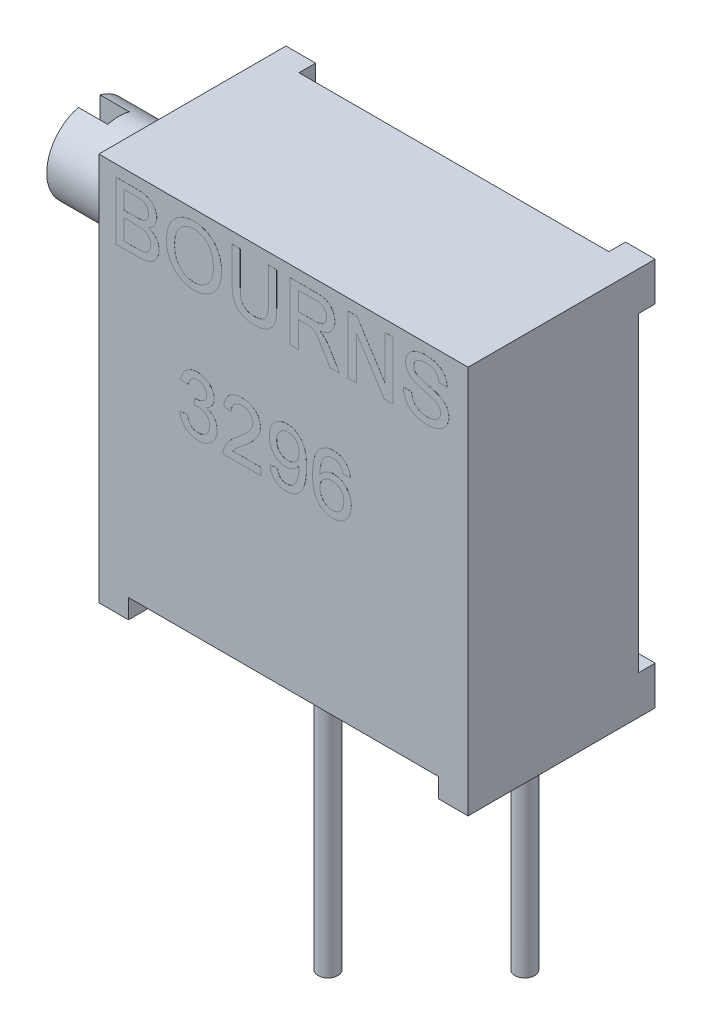
from build123d import *

# Parameters (mm, degrees)
SKETCH1_W          = 9.53
SKETCH1_H          = 10.03
EXTRUDE1_DEPTH     = 4.4
SKETCH2_W          = 8
SKETCH2_H          = 0.5
CUT_EXTRUDE1_DEPTH = 12.94429257
SKETCH3_W          = 0.765
SKETCH3_H          = 1
EXTRUDE2_DEPTH     = 0.43
EXTRUDE5_DEPTH     = 0.001
SKETCH9_R          = 0.255
EXTRUDE7_DEPTH     = 6.9
SKETCH_1_R         = 1.095
EXTRUDE8_DEPTH     = 1.52
SKETCH_2_W         = 0.56
SKETCH_2_H         = 4.322685763
CUT_EXTRUDE3_DEPTH = 0.76


with BuildPart() as part:
    # Sketch1 → Extrude1 (new body)
    with BuildSketch(Plane.XY):
        with Locations((0, 5.015)):
            Rectangle(SKETCH1_W, SKETCH1_H)
    extrude(amount=EXTRUDE1_DEPTH)

    # Sketch2 → Cut-Extrude1 (cut, through all)
    with BuildSketch(Plane.XY.offset(4.4)):
        with Locations((0, 0.25)):
            Rectangle(SKETCH2_W, SKETCH2_H)
    extrude(amount=-CUT_EXTRUDE1_DEPTH, mode=Mode.SUBTRACT)

    # Sketch3 → Extrude2 (add)
    with BuildSketch(Plane(origin=(0, 0, 0), x_dir=(-1, 0, 0), z_dir=(0, 0, -1))):
        with Locations((-4.3825, 0.5)):
            Rectangle(SKETCH3_W, SKETCH3_H)
        with Locations((4.3825, 0.5)):
            Rectangle(SKETCH3_W, SKETCH3_H)
        with Locations((4.3825, 9.53)):
            Rectangle(SKETCH3_W, SKETCH3_H)
        with Locations((-4.3825, 9.53)):
            Rectangle(SKETCH3_W, SKETCH3_H)
    extrude(amount=EXTRUDE2_DEPTH)

    # Sketch7 → Extrude5 (add)
    # profile 1 of 10: a face of its own
    with BuildSketch(Plane.XY.offset(4.4)):
        with BuildLine():
            Line((-4.326444342, 8.237150921), (-4.326444342, 9.737150921))
            Line((-4.326444342, 9.737150921), (-3.764845784, 9.737150921))
            add(Edge.make_bspline(
                [(-3.764845784, 9.737150921), (-3.750919069, 9.737097495), (-3.723744088, 9.736993245), (-3.684062996, 9.734386066), (-3.64648204, 9.730819986), (-3.610920315, 9.726223199), (-3.577531697, 9.719553354), (-3.5463473, 9.711473284), (-3.517204841, 9.702153183), (-3.481582627, 9.687955652), (-3.44053193, 9.666102632), (-3.396562734, 9.63349448), (-3.358307825, 9.594343785), (-3.326829661, 9.549455296), (-3.300895048, 9.501505925), (-3.282507712, 9.451409151), (-3.270751692, 9.400255705), (-3.269417834, 9.365618225), (-3.268752034, 9.348328806)],
                knots=[0, 0, 0, 0, 0.939712594, 1.833646414, 2.682508961, 3.487467313, 4.25240329, 4.978730417, 5.660668875, 6.315918528, 7.564895217, 8.787077865, 9.996481721, 11.241996224, 12.475862915, 13.665015424, 14.834484263, 16, 16, 16, 16], degree=3))
            add(Edge.make_bspline(
                [(-3.268752034, 9.348328806), (-3.26945193, 9.332243346), (-3.270844975, 9.300227505), (-3.281932051, 9.253066225), (-3.29943085, 9.207272915), (-3.324174647, 9.163404285), (-3.35580032, 9.122262901), (-3.395007125, 9.085240754), (-3.441231661, 9.052258501), (-3.475923175, 9.03467799), (-3.49381213, 9.025612459)],
                knots=[0, 0, 0, 0, 0.926741525, 1.844548388, 2.778836836, 3.746021974, 4.738420572, 5.759761325, 6.844803049, 8, 8, 8, 8], degree=3))
            add(Edge.make_bspline(
                [(-3.49381213, 9.025612459), (-3.482745904, 9.022148256), (-3.461080115, 9.015365935), (-3.429933293, 9.002955239), (-3.40069594, 8.988823885), (-3.373304413, 8.972948652), (-3.347943795, 8.955182527), (-3.324685642, 8.935497814), (-3.303368694, 8.914199128), (-3.284031035, 8.891299426), (-3.267044931, 8.866946071), (-3.251810517, 8.841671332), (-3.2392306, 8.815170846), (-3.228919301, 8.787513414), (-3.220874955, 8.758869935), (-3.215098238, 8.729130241), (-3.211805658, 8.698363557), (-3.211311122, 8.677463121), (-3.211059726, 8.666838421)],
                knots=[0, 0, 0, 0, 1.127427615, 2.20731145, 3.257257018, 4.283066884, 5.282973838, 6.264540225, 7.242620376, 8.210460609, 9.17525685, 10.12748095, 11.077310519, 12.023587065, 12.994999128, 13.967387486, 14.966724908, 16, 16, 16, 16], degree=3))
            add(Edge.make_bspline(
                [(-3.211059726, 8.666838421), (-3.211577892, 8.649780613), (-3.212604959, 8.615969962), (-3.220853456, 8.56620637), (-3.234792977, 8.518337989), (-3.253979542, 8.473138792), (-3.276841107, 8.43134548), (-3.302824076, 8.394052338), (-3.331265831, 8.36164311), (-3.362967261, 8.334381157), (-3.397723879, 8.311243736), (-3.436517359, 8.291760514), (-3.479047757, 8.27457818), (-3.526179479, 8.260852297), (-3.577891071, 8.249948474), (-3.634884306, 8.242864242), (-3.697246747, 8.237792882), (-3.74069542, 8.237370888), (-3.76334338, 8.237150921)],
                knots=[0, 0, 0, 0, 1.028073207, 2.037766189, 3.031549473, 4.027532207, 4.992436545, 5.898794514, 6.762903869, 7.584966804, 8.412380356, 9.273953678, 10.198004568, 11.174406109, 12.229717296, 13.381036288, 14.634844708, 16, 16, 16, 16], degree=3))
            Line((-3.76334338, 8.237150921), (-4.326444342, 8.237150921))
        make_face()
        with BuildLine():
            Line((-4.11490588, 9.102535536), (-3.805711169, 9.102535536))
            add(Edge.make_bspline(
                [(-3.805711169, 9.102535536), (-3.795593548, 9.102575565), (-3.776155313, 9.10265247), (-3.748116122, 9.103724756), (-3.722237293, 9.104639569), (-3.698618928, 9.106935678), (-3.677144021, 9.109184615), (-3.65789851, 9.112212035), (-3.640788132, 9.115623251), (-3.630311444, 9.11878741), (-3.625422707, 9.120263902)],
                knots=[0, 0, 0, 0, 1.335841395, 2.566453063, 3.705076039, 4.753984432, 5.69893722, 6.555639608, 7.326018133, 8, 8, 8, 8], degree=3))
            add(Edge.make_bspline(
                [(-3.625422707, 9.120263902), (-3.613935929, 9.124287721), (-3.591791825, 9.132044802), (-3.562116654, 9.149661914), (-3.536842034, 9.170802362), (-3.516035695, 9.195839435), (-3.500047055, 9.224639144), (-3.48819194, 9.256604254), (-3.481701001, 9.292181608), (-3.480773445, 9.316853252), (-3.480290496, 9.329698998)],
                knots=[0, 0, 0, 0, 1.059015028, 2.041559358, 2.989777133, 3.920090524, 4.862499371, 5.848878527, 6.879979022, 8, 8, 8, 8], degree=3))
            add(Edge.make_bspline(
                [(-3.480290496, 9.329698998), (-3.480678819, 9.342044591), (-3.481435618, 9.366104727), (-3.487788265, 9.401044217), (-3.498781285, 9.433548996), (-3.513668845, 9.463611935), (-3.532520451, 9.490357237), (-3.555020501, 9.513351936), (-3.581973973, 9.530734916), (-3.607167395, 9.541578455), (-3.629826882, 9.548362111), (-3.650072338, 9.552375722), (-3.673036723, 9.555912112), (-3.698795607, 9.558918633), (-3.727358734, 9.56125197), (-3.758814112, 9.563105652), (-3.793086864, 9.56389268), (-3.816828774, 9.564012054), (-3.829148669, 9.564073998)],
                knots=[0, 0, 0, 0, 1.216168307, 2.37017178, 3.484610845, 4.588286376, 5.664695412, 6.69777344, 7.738183022, 8.803673002, 9.390844981, 10.0665252, 10.835811589, 11.680682236, 12.621801058, 13.660007223, 14.785756265, 16, 16, 16, 16], degree=3))
            Line((-3.829148669, 9.564073998), (-4.11490588, 9.564073998))
            Line((-4.11490588, 9.564073998), (-4.11490588, 9.102535536))
        make_face(mode=Mode.SUBTRACT)
        with BuildLine():
            Line((-4.11490588, 8.410227844), (-3.760038092, 8.410227844))
            add(Edge.make_bspline(
                [(-3.760038092, 8.410227844), (-3.745915172, 8.410390096), (-3.719967473, 8.410688199), (-3.68447609, 8.41162336), (-3.655788079, 8.41390761), (-3.639035797, 8.416367164), (-3.631732803, 8.417439383)],
                knots=[0, 0, 0, 0, 1.317581857, 2.420761387, 3.311546315, 4, 4, 4, 4], degree=3))
            add(Edge.make_bspline(
                [(-3.631732803, 8.417439383), (-3.621262478, 8.419640139), (-3.60098922, 8.423901372), (-3.572408792, 8.433412), (-3.546204152, 8.444306931), (-3.522832664, 8.458153179), (-3.501191226, 8.47411003), (-3.482383206, 8.494040902), (-3.465060127, 8.516685746), (-3.450051204, 8.542600195), (-3.43791431, 8.571268479), (-3.42863829, 8.602247654), (-3.423697206, 8.635429101), (-3.422969697, 8.658209966), (-3.422598188, 8.669843229)],
                knots=[0, 0, 0, 0, 1.067651492, 2.067249321, 3.003744366, 3.895862395, 4.774133402, 5.679610569, 6.621910665, 7.616993802, 8.661192143, 9.724711987, 10.838102842, 12, 12, 12, 12], degree=3))
            add(Edge.make_bspline(
                [(-3.422598188, 8.669843229), (-3.42301209, 8.683501376), (-3.42381924, 8.710136157), (-3.431491485, 8.748624765), (-3.444164778, 8.784323428), (-3.462005081, 8.816737755), (-3.483887144, 8.845891651), (-3.51036223, 8.870622107), (-3.541232376, 8.890246947), (-3.576592458, 8.905648649), (-3.617921311, 8.916606694), (-3.666359943, 8.924041064), (-3.722683143, 8.928838285), (-3.762931606, 8.929242981), (-3.784377034, 8.929458613)],
                knots=[0, 0, 0, 0, 0.96167883, 1.875371887, 2.752872588, 3.621584364, 4.472914353, 5.312011319, 6.159851575, 7.038572308, 8.019870099, 9.164119506, 10.488969081, 12, 12, 12, 12], degree=3))
            Line((-3.784377034, 8.929458613), (-4.11490588, 8.929458613))
            Line((-4.11490588, 8.929458613), (-4.11490588, 8.410227844))
        make_face(mode=Mode.SUBTRACT)
    # profile 2 of 10: a face of its own
    with BuildSketch(Plane.XY.offset(4.4)):
        with BuildLine():
            add(Edge.make_bspline(
                [(-3.018752034, 8.96731919), (-3.018230692, 8.997392897), (-3.017214883, 9.055989991), (-3.007723632, 9.141314909), (-2.992312277, 9.221594495), (-2.970280381, 9.296822497), (-2.942354889, 9.367116795), (-2.90840612, 9.432636561), (-2.867412916, 9.492640158), (-2.821039156, 9.547698782), (-2.769241797, 9.596374641), (-2.714092331, 9.639605778), (-2.654902115, 9.675665657), (-2.592218021, 9.705439229), (-2.525773732, 9.728298516), (-2.455755803, 9.744302096), (-2.382239117, 9.754625961), (-2.331988742, 9.755787946), (-2.30631213, 9.75638169)],
                knots=[0, 0, 0, 0, 1.203621547, 2.345195544, 3.432004029, 4.472479546, 5.478447225, 6.455936844, 7.420185704, 8.381829745, 9.332027588, 10.260832629, 11.182364398, 12.100723901, 13.034044877, 13.989196293, 14.972532542, 16, 16, 16, 16], degree=3))
            add(Edge.make_bspline(
                [(-2.30631213, 9.75638169), (-2.289376641, 9.756085965), (-2.255745821, 9.755498707), (-2.206025657, 9.751030463), (-2.157583125, 9.74305542), (-2.110465931, 9.732367968), (-2.064545821, 9.718346497), (-2.019795371, 9.701794576), (-1.976606323, 9.681284416), (-1.934691352, 9.658321251), (-1.894545231, 9.632635958), (-1.856816008, 9.604261466), (-1.821594055, 9.573412372), (-1.788406246, 9.540595749), (-1.758360012, 9.504704083), (-1.730214065, 9.466830696), (-1.704777197, 9.426304031), (-1.681959152, 9.383456134), (-1.661557501, 9.338948785), (-1.644120351, 9.292597519), (-1.629147388, 9.24495835), (-1.616613755, 9.195749307), (-1.607620535, 9.144987212), (-1.600459136, 9.092890794), (-1.596689895, 9.039289785), (-1.596016226, 9.003081348), (-1.595675111, 8.984747075)],
                knots=[0, 0, 0, 0, 1.034375294, 2.054082248, 3.045783978, 4.031219655, 5.002789406, 5.976610191, 6.94273282, 7.920236376, 8.894345378, 9.851183672, 10.800797181, 11.752517031, 12.698794154, 13.65688337, 14.632873302, 15.61821402, 16.620222298, 17.621258913, 18.640965868, 19.669244166, 20.720417492, 21.788124603, 22.880008887, 24, 24, 24, 24], degree=3))
            add(Edge.make_bspline(
                [(-1.595675111, 8.984747075), (-1.595987646, 8.966110469), (-1.596605114, 8.929290641), (-1.600783152, 8.87489649), (-1.608129594, 8.822063882), (-1.617873399, 8.77063528), (-1.630929801, 8.720717747), (-1.646445328, 8.672168168), (-1.665212234, 8.625275712), (-1.686407371, 8.579927361), (-1.71038966, 8.536746809), (-1.736843752, 8.496035998), (-1.765788388, 8.458175743), (-1.796783902, 8.422701596), (-1.830554122, 8.390247902), (-1.866683213, 8.360511195), (-1.90503226, 8.333211022), (-1.945730096, 8.30908676), (-1.988046343, 8.287940982), (-2.031143628, 8.269180868), (-2.075053966, 8.253181495), (-2.119927428, 8.240215594), (-2.165641605, 8.230417626), (-2.21206785, 8.223080805), (-2.259358356, 8.218856237), (-2.291179863, 8.218233784), (-2.307213572, 8.217920152)],
                knots=[0, 0, 0, 0, 1.141429366, 2.255090526, 3.338676798, 4.407031443, 5.458968682, 6.496860253, 7.526652771, 8.550250826, 9.560787671, 10.54935636, 11.521089193, 12.477323897, 13.431786008, 14.386110112, 15.340986122, 16.312041, 17.28047646, 18.236612773, 19.189437236, 20.140779471, 21.09494583, 22.051062463, 23.018000708, 24, 24, 24, 24], degree=3))
            add(Edge.make_bspline(
                [(-2.307213572, 8.217920152), (-2.324453371, 8.218175217), (-2.358601094, 8.218680436), (-2.409072348, 8.223723391), (-2.458287957, 8.231416594), (-2.506104842, 8.242523255), (-2.552457663, 8.25701268), (-2.597401266, 8.27455022), (-2.641093722, 8.294901493), (-2.682992881, 8.318649222), (-2.722956135, 8.345054144), (-2.760596145, 8.373985002), (-2.795892098, 8.405175171), (-2.828277639, 8.439140188), (-2.858801633, 8.474648809), (-2.886243593, 8.513020865), (-2.911499732, 8.55338612), (-2.933822678, 8.596133677), (-2.95398812, 8.639993241), (-2.97097794, 8.68497884), (-2.985908699, 8.730427507), (-2.997799537, 8.776619369), (-3.007275088, 8.823447871), (-3.01364671, 8.870835093), (-3.018248343, 8.918851609), (-3.018583292, 8.951082028), (-3.018752034, 8.96731919)],
                knots=[0, 0, 0, 0, 1.072727997, 2.12480551, 3.153819198, 4.171534612, 5.177148798, 6.173931848, 7.17235114, 8.174500385, 9.168706755, 10.151274001, 11.127173509, 12.097141049, 13.070188938, 14.039134204, 15.03036519, 16.031505612, 17.038625933, 18.033164522, 19.022845559, 20.014762458, 21.000193215, 21.994692725, 22.989758729, 24, 24, 24, 24], degree=3))
        make_face()
        with BuildLine():
            add(Edge.make_bspline(
                [(-2.807213572, 8.964915344), (-2.8068894, 8.943259561), (-2.806257286, 8.901032314), (-2.799025562, 8.839467232), (-2.788052575, 8.781377442), (-2.772927471, 8.726599873), (-2.752595628, 8.675676265), (-2.728286277, 8.628117292), (-2.699180916, 8.584239101), (-2.665921697, 8.544164434), (-2.629340369, 8.508164356), (-2.590249507, 8.476720203), (-2.548640324, 8.450387949), (-2.504974133, 8.428645052), (-2.458937298, 8.411672739), (-2.410667702, 8.399755208), (-2.360129877, 8.39230176), (-2.325669313, 8.391437388), (-2.308115015, 8.390997075)],
                knots=[0, 0, 0, 0, 1.215430442, 2.370003584, 3.475209778, 4.53279855, 5.55522989, 6.548792651, 7.526809858, 8.505409025, 9.467826767, 10.404123909, 11.316848639, 12.227335424, 13.138360512, 14.065900994, 15.014765094, 16, 16, 16, 16], degree=3))
            add(Edge.make_bspline(
                [(-2.308115015, 8.390997075), (-2.290263171, 8.3914439), (-2.25530931, 8.392318784), (-2.204009559, 8.399642118), (-2.155269053, 8.412109783), (-2.108604686, 8.42870707), (-2.064860106, 8.451143772), (-2.02301225, 8.477417027), (-1.984201898, 8.509522192), (-1.947476365, 8.54558594), (-1.914536035, 8.586579013), (-1.885308427, 8.631491621), (-1.861565976, 8.680997339), (-1.841067574, 8.734005623), (-1.826057462, 8.791518352), (-1.81496407, 8.85288172), (-1.808278957, 8.918293114), (-1.80757498, 8.963196823), (-1.807213572, 8.986249479)],
                knots=[0, 0, 0, 0, 0.976878588, 1.912725521, 2.8289017, 3.727303729, 4.617335839, 5.514666588, 6.426584173, 7.368641557, 8.327632997, 9.299405846, 10.294892156, 11.327373912, 12.405931897, 13.542618837, 14.738430195, 16, 16, 16, 16], degree=3))
            add(Edge.make_bspline(
                [(-1.807213572, 8.986249479), (-1.807341294, 9.001080057), (-1.807591837, 9.030172285), (-1.810909864, 9.073054562), (-1.815189695, 9.114602954), (-1.821705802, 9.15476385), (-1.830685826, 9.193370934), (-1.840634167, 9.230718122), (-1.853074219, 9.266483577), (-1.867189192, 9.300807558), (-1.882983608, 9.333513851), (-1.900797609, 9.36432673), (-1.920424159, 9.3931264), (-1.941333711, 9.420458875), (-1.964684118, 9.445266276), (-1.989351045, 9.468596479), (-2.015894798, 9.489967476), (-2.044050482, 9.509384851), (-2.073418672, 9.526863548), (-2.103938825, 9.541823045), (-2.135124711, 9.554963084), (-2.167498339, 9.565035475), (-2.200612691, 9.573159006), (-2.234601633, 9.579329585), (-2.269591323, 9.582524997), (-2.293185557, 9.583042977), (-2.305110207, 9.583304767)],
                knots=[0, 0, 0, 0, 1.220438779, 2.394059227, 3.538503547, 4.658058814, 5.74010225, 6.800155734, 7.837851593, 8.854470756, 9.853724944, 10.825214244, 11.781044712, 12.72106398, 13.654479919, 14.581868691, 15.514082315, 16.456304431, 17.39516604, 18.324312202, 19.252140633, 20.177768678, 21.111585046, 22.057694709, 23.018348693, 24, 24, 24, 24], degree=3))
            add(Edge.make_bspline(
                [(-2.305110207, 9.583304767), (-2.321964073, 9.582970056), (-2.355218629, 9.582309634), (-2.404173295, 9.574968014), (-2.4513709, 9.56399863), (-2.496884691, 9.548662848), (-2.540325395, 9.528355862), (-2.581918075, 9.503452123), (-2.622031926, 9.47462972), (-2.660034411, 9.441186401), (-2.695461039, 9.402768193), (-2.725410699, 9.357474302), (-2.750653091, 9.30638599), (-2.771730023, 9.249632752), (-2.787800563, 9.186775074), (-2.798907316, 9.11808346), (-2.805919894, 9.043485528), (-2.806771322, 8.991774955), (-2.807213572, 8.964915344)],
                knots=[0, 0, 0, 0, 0.895090134, 1.766112571, 2.624765742, 3.468151641, 4.313618154, 5.168136083, 6.041303099, 6.935189387, 7.854749729, 8.809996334, 9.809869957, 10.877771942, 12.021723904, 13.25217762, 14.572720513, 16, 16, 16, 16], degree=3))
        make_face(mode=Mode.SUBTRACT)
    # profile 3 of 10: a face of its own
    with BuildSketch(Plane.XY.offset(4.4)):
        with BuildLine():
            Line((-0.384136649, 9.737150921), (-0.172598188, 9.737150921))
            Line((-0.172598188, 9.737150921), (-0.172598188, 8.874170152))
            add(Edge.make_bspline(
                [(-0.172598188, 8.874170152), (-0.172817713, 8.855839279), (-0.17324491, 8.820167371), (-0.175210197, 8.768143941), (-0.179038667, 8.719011196), (-0.184899968, 8.672848597), (-0.19152619, 8.629455925), (-0.200351288, 8.589070404), (-0.210472953, 8.551529041), (-0.222118871, 8.516578197), (-0.236215171, 8.483981753), (-0.252320236, 8.453041696), (-0.27110134, 8.423667691), (-0.292509773, 8.395904321), (-0.316659126, 8.369903341), (-0.342889972, 8.34499824), (-0.371894747, 8.32187367), (-0.403354379, 8.300264922), (-0.437307933, 8.280653275), (-0.473904053, 8.263733066), (-0.513098094, 8.24978275), (-0.554713075, 8.237914738), (-0.59895675, 8.229115881), (-0.645687182, 8.222441781), (-0.694966239, 8.218516166), (-0.728680904, 8.218121765), (-0.745915496, 8.217920152)],
                knots=[0, 0, 0, 0, 1.311435591, 2.552055809, 3.723716842, 4.835547674, 5.880436826, 6.862821995, 7.791032428, 8.661143393, 9.495683908, 10.328993084, 11.1538804, 11.986573222, 12.833449924, 13.690091648, 14.571895854, 15.484149563, 16.418232274, 17.373591634, 18.364096258, 19.391643703, 20.466661433, 21.588422397, 22.767226238, 24, 24, 24, 24], degree=3))
            add(Edge.make_bspline(
                [(-0.745915496, 8.217920152), (-0.762747176, 8.218167913), (-0.795542393, 8.218650658), (-0.843600901, 8.221914973), (-0.889315102, 8.227699697), (-0.932822961, 8.235291305), (-0.973978437, 8.245579942), (-1.01272043, 8.258173326), (-1.049181209, 8.272904412), (-1.083365134, 8.2896649), (-1.11487259, 8.309015777), (-1.144260591, 8.330138013), (-1.171397739, 8.353261603), (-1.19603194, 8.378594967), (-1.218455258, 8.405756623), (-1.238355176, 8.435036855), (-1.255779343, 8.466487887), (-1.271165901, 8.500026899), (-1.284571795, 8.536147585), (-1.295381776, 8.575342209), (-1.305161568, 8.617510171), (-1.312667758, 8.662804669), (-1.319261137, 8.711168829), (-1.323084681, 8.762745583), (-1.325997838, 8.817446196), (-1.326292931, 8.854934905), (-1.326444342, 8.874170152)],
                knots=[0, 0, 0, 0, 1.192889473, 2.324252067, 3.41162405, 4.457325556, 5.452435892, 6.415456921, 7.342133401, 8.237363544, 9.110250727, 9.959377435, 10.800155199, 11.633438097, 12.46053001, 13.293359256, 14.138649731, 15.005774073, 15.906391469, 16.865847877, 17.8852706, 18.972920589, 20.118424796, 21.343408205, 22.636917643, 24, 24, 24, 24], degree=3))
            Line((-1.326444342, 8.874170152), (-1.326444342, 9.737150921))
            Line((-1.326444342, 9.737150921), (-1.11490588, 9.737150921))
            Line((-1.11490588, 9.737150921), (-1.11490588, 8.884086017))
            add(Edge.make_bspline(
                [(-1.11490588, 8.884086017), (-1.114767658, 8.868560422), (-1.114500957, 8.838603557), (-1.113109482, 8.795207672), (-1.110326775, 8.754936554), (-1.106886612, 8.717728723), (-1.102157025, 8.683718544), (-1.09610028, 8.652955825), (-1.089306625, 8.625335805), (-1.079133218, 8.593035516), (-1.062246323, 8.556979041), (-1.035633784, 8.518762127), (-1.003161194, 8.485560874), (-0.964517851, 8.458141879), (-0.920633994, 8.436355447), (-0.871805449, 8.421333433), (-0.818611502, 8.411672805), (-0.781617528, 8.410721136), (-0.762441938, 8.410227844)],
                knots=[0, 0, 0, 0, 1.090245215, 2.103644224, 3.048223674, 3.924421557, 4.727106666, 5.45815927, 6.12513286, 6.723455763, 7.834131158, 8.905266051, 9.9795367, 11.078391299, 12.21701853, 13.404826756, 14.65480846, 16, 16, 16, 16], degree=3))
            add(Edge.make_bspline(
                [(-0.762441938, 8.410227844), (-0.746007063, 8.410507631), (-0.714272984, 8.411047872), (-0.668513344, 8.415404728), (-0.6265627, 8.423347367), (-0.588072882, 8.433582839), (-0.553314751, 8.447483141), (-0.522075787, 8.464324146), (-0.494465601, 8.484196483), (-0.470286071, 8.507638528), (-0.449452221, 8.535691341), (-0.431893065, 8.569123488), (-0.416934773, 8.607964106), (-0.404676645, 8.652341416), (-0.395738752, 8.702466188), (-0.388751711, 8.758015588), (-0.385088051, 8.819233831), (-0.384462913, 8.861846319), (-0.384136649, 8.884086017)],
                knots=[0, 0, 0, 0, 1.111629428, 2.146443922, 3.104513091, 3.997025448, 4.836178689, 5.630482806, 6.392099463, 7.129930272, 7.899580577, 8.745272349, 9.676297551, 10.710246713, 11.854352966, 13.117392195, 14.495550762, 16, 16, 16, 16], degree=3))
            Line((-0.384136649, 8.884086017), (-0.384136649, 9.737150921))
        make_face()
    # profile 4 of 10: a face of its own
    with BuildSketch(Plane.XY.offset(4.4)):
        with BuildLine():
            Line((0.173555658, 8.237150921), (0.173555658, 9.737150921))
            Line((0.173555658, 9.737150921), (0.824397004, 9.737150921))
            add(Edge.make_bspline(
                [(0.824397004, 9.737150921), (0.839722325, 9.737030841), (0.86938269, 9.73679844), (0.912396343, 9.735153303), (0.952545276, 9.731606819), (0.98990331, 9.727771792), (1.024463806, 9.721885537), (1.05619111, 9.715134136), (1.085134208, 9.707099866), (1.111422492, 9.697610774), (1.135812287, 9.686875288), (1.158419785, 9.673629431), (1.18018475, 9.659114797), (1.200299409, 9.642062268), (1.219294287, 9.623391327), (1.237151779, 9.602848275), (1.25360752, 9.580254841), (1.273903706, 9.547918952), (1.295677375, 9.504854357), (1.313818262, 9.449741006), (1.325515181, 9.39209043), (1.326766785, 9.352692939), (1.327401812, 9.332703806)],
                knots=[0, 0, 0, 0, 1.242255013, 2.404239178, 3.487702428, 4.508875116, 5.447164253, 6.327763259, 7.137389581, 7.87956647, 8.591787438, 9.293660819, 10.000726923, 10.709654955, 11.427269343, 12.158170644, 12.913245971, 13.690346794, 15.251572448, 16.809945773, 18.381459854, 20, 20, 20, 20], degree=3))
            add(Edge.make_bspline(
                [(1.327401812, 9.332703806), (1.327108288, 9.319872565), (1.326528558, 9.294529983), (1.322087769, 9.257269606), (1.314052519, 9.221668814), (1.303748895, 9.187415821), (1.289646376, 9.154995938), (1.273309221, 9.123746979), (1.253069809, 9.094527437), (1.230409548, 9.066559241), (1.204424306, 9.040441395), (1.17488549, 9.017116168), (1.142085913, 8.99613508), (1.105871101, 8.978077007), (1.066657924, 8.96157107), (1.023954363, 8.948279695), (0.977932767, 8.937426268), (0.946028457, 8.93217062), (0.929565274, 8.929458613)],
                knots=[0, 0, 0, 0, 0.982609109, 1.940720374, 2.867584677, 3.775009516, 4.675469332, 5.571146231, 6.471115823, 7.392408543, 8.32534739, 9.286126426, 10.269214477, 11.301811357, 12.381622301, 13.524260118, 14.722474812, 16, 16, 16, 16], degree=3))
            add(Edge.make_bspline(
                [(0.929565274, 8.929458613), (0.941641642, 8.923357898), (0.964575101, 8.911772421), (0.996326759, 8.893606493), (1.02324154, 8.875045391), (1.038834637, 8.861769945), (1.046151812, 8.855540344)],
                knots=[0, 0, 0, 0, 1.172304973, 2.226249348, 3.167654437, 4, 4, 4, 4], degree=3))
            add(Edge.make_bspline(
                [(1.046151812, 8.855540344), (1.060321936, 8.841649482), (1.089428377, 8.813116664), (1.129538316, 8.764516917), (1.16842628, 8.710417941), (1.192053651, 8.671320427), (1.204204697, 8.651213421)],
                knots=[0, 0, 0, 0, 0.918110279, 1.885863737, 2.912745394, 4, 4, 4, 4], degree=3))
            Line((1.204204697, 8.651213421), (1.450298447, 8.237150921))
            Line((1.450298447, 8.237150921), (1.207810466, 8.237150921))
            Line((1.207810466, 8.237150921), (1.020911428, 8.553857652))
            add(Edge.make_bspline(
                [(1.020911428, 8.553857652), (1.014191477, 8.564969688), (1.001169316, 8.58650299), (0.982359271, 8.617951341), (0.96391664, 8.646904558), (0.946811416, 8.674190141), (0.930349439, 8.699312734), (0.914689771, 8.722359607), (0.900263372, 8.743633105), (0.882394413, 8.768400992), (0.861597912, 8.79580689), (0.837329822, 8.82402979), (0.814219405, 8.846531531), (0.7857585, 8.868596883), (0.750505364, 8.88923531), (0.720539532, 8.898718101), (0.706007581, 8.903316786)],
                knots=[0, 0, 0, 0, 1.130940588, 2.191577161, 3.191089816, 4.120344442, 4.99615009, 5.80661983, 6.546979556, 7.234477901, 8.466216387, 9.541989141, 10.473533583, 11.269175393, 12.675684693, 14, 14, 14, 14], degree=3))
            add(Edge.make_bspline(
                [(0.706007581, 8.903316786), (0.699910513, 8.904416295), (0.685990724, 8.906926506), (0.662354957, 8.908565929), (0.633717326, 8.910305957), (0.612963146, 8.910255258), (0.601740754, 8.910227844)],
                knots=[0, 0, 0, 0, 0.709978628, 1.620902492, 2.713552433, 4, 4, 4, 4], degree=3))
            Line((0.601740754, 8.910227844), (0.38509412, 8.910227844))
            Line((0.38509412, 8.910227844), (0.38509412, 8.237150921))
            Line((0.38509412, 8.237150921), (0.173555658, 8.237150921))
        make_face()
        with BuildLine():
            Line((0.38509412, 9.083304767), (0.786836908, 9.083304767))
            add(Edge.make_bspline(
                [(0.786836908, 9.083304767), (0.806981813, 9.083619953), (0.844640824, 9.084209164), (0.897300993, 9.089240406), (0.942179174, 9.097235264), (0.980162544, 9.108896699), (1.012074571, 9.125086645), (1.039829066, 9.144817119), (1.062893402, 9.169531591), (1.082080546, 9.197416611), (1.096995107, 9.228102684), (1.10775376, 9.260333904), (1.114795486, 9.29383939), (1.115504243, 9.31664276), (1.115863351, 9.328196594)],
                knots=[0, 0, 0, 0, 1.546323217, 2.890706218, 4.056530419, 5.041445823, 5.928701482, 6.793137403, 7.641659452, 8.509781392, 9.383301667, 10.251423607, 11.114044887, 12, 12, 12, 12], degree=3))
            add(Edge.make_bspline(
                [(1.115863351, 9.328196594), (1.115584159, 9.336616312), (1.115037306, 9.353108067), (1.11217052, 9.377313385), (1.106596807, 9.400314031), (1.099236732, 9.422231591), (1.089402179, 9.442905533), (1.07771913, 9.462496058), (1.063777647, 9.480894587), (1.047808481, 9.498157164), (1.029472975, 9.513864423), (1.008529518, 9.52741638), (0.985143287, 9.538932621), (0.959287102, 9.548072679), (0.931042413, 9.555383237), (0.90024843, 9.560246716), (0.86704598, 9.563765913), (0.844038607, 9.563969384), (0.832209504, 9.564073998)],
                knots=[0, 0, 0, 0, 0.965208469, 1.890559848, 2.786986821, 3.67262109, 4.535197034, 5.405224191, 6.282113641, 7.175449223, 8.095446547, 9.040936516, 10.026471658, 11.075712529, 12.17809725, 13.364958037, 14.645208957, 16, 16, 16, 16], degree=3))
            Line((0.832209504, 9.564073998), (0.38509412, 9.564073998))
            Line((0.38509412, 9.564073998), (0.38509412, 9.083304767))
        make_face(mode=Mode.SUBTRACT)
    # profile 5 of 10: a face of its own
    with BuildSketch(Plane.XY.offset(4.4)):
        Polygon((1.673555658, 8.237150921), (1.673555658, 9.737150921), (1.897113351, 9.737150921), (2.615863351, 8.617860056), (2.615863351, 9.737150921), (2.827401812, 9.737150921), (2.827401812, 8.237150921), (2.60384412, 8.237150921), (1.88509412, 9.356441786), (1.88509412, 8.237150921), align=None)
    # profile 6 of 10: a face of its own
    with BuildSketch(Plane.XY.offset(4.4)):
        with BuildLine():
            Line((3.096632581, 8.75638169), (3.308171043, 8.75638169))
            add(Edge.make_bspline(
                [(3.308171043, 8.75638169), (3.310497843, 8.737388445), (3.314967752, 8.700901399), (3.327466063, 8.649186503), (3.343552197, 8.602689505), (3.363595075, 8.560793306), (3.389960718, 8.52400024), (3.421726783, 8.490813457), (3.460304939, 8.462075712), (3.503850884, 8.436501001), (3.552348913, 8.416420809), (3.604124885, 8.401535032), (3.658931873, 8.39271509), (3.696460325, 8.391577796), (3.715622966, 8.390997075)],
                knots=[0, 0, 0, 0, 1.125557648, 2.162256852, 3.1243583, 4.018160113, 4.88511607, 5.777380551, 6.711250965, 7.707237736, 8.743031335, 9.791730543, 10.872421559, 12, 12, 12, 12], degree=3))
            add(Edge.make_bspline(
                [(3.715622966, 8.390997075), (3.732580253, 8.391310936), (3.765643678, 8.391922905), (3.813473618, 8.399274166), (3.858481731, 8.409701733), (3.899830369, 8.42547506), (3.937367, 8.444628825), (3.969963359, 8.467795753), (3.997792396, 8.493921683), (4.019584549, 8.523694759), (4.03670403, 8.554891964), (4.049262938, 8.586959473), (4.056744023, 8.619719296), (4.057697308, 8.641761795), (4.058171043, 8.652715825)],
                knots=[0, 0, 0, 0, 1.267006637, 2.470417599, 3.611360613, 4.716023143, 5.771382139, 6.754486395, 7.697536124, 8.612899418, 9.501261124, 10.352596716, 11.181322154, 12, 12, 12, 12], degree=3))
            add(Edge.make_bspline(
                [(4.058171043, 8.652715825), (4.057664611, 8.663558897), (4.056674791, 8.684751666), (4.050224406, 8.71560569), (4.037964538, 8.743846084), (4.022055951, 8.770625489), (3.99992439, 8.795109454), (3.97196366, 8.817669243), (3.937557717, 8.838122166), (3.911878856, 8.849323379), (3.898315274, 8.855239863)],
                knots=[0, 0, 0, 0, 0.942140154, 1.841411588, 2.718743672, 3.605002079, 4.535543111, 5.568170452, 6.715506882, 8, 8, 8, 8], degree=3))
            add(Edge.make_bspline(
                [(3.898315274, 8.855239863), (3.893030701, 8.857408477), (3.881091893, 8.86230777), (3.860629335, 8.868793591), (3.836347919, 8.877180419), (3.807664303, 8.885817486), (3.774732043, 8.894954296), (3.737605968, 8.905295779), (3.696306823, 8.91629338), (3.652005924, 8.927999128), (3.607275516, 8.93990208), (3.564540836, 8.951816178), (3.5252229, 8.963910513), (3.488999639, 8.975555689), (3.456057801, 8.987248909), (3.42630389, 8.998670037), (3.39970081, 9.009587356), (3.383452661, 9.017614692), (3.375779216, 9.021405729)],
                knots=[0, 0, 0, 0, 0.499201778, 1.127787504, 1.87543728, 2.745208432, 3.745951656, 4.863402235, 6.114490242, 7.482339553, 8.869366102, 10.161191451, 11.360587006, 12.46547846, 13.487450326, 14.41601931, 15.251940103, 16, 16, 16, 16], degree=3))
            add(Edge.make_bspline(
                [(3.375779216, 9.021405729), (3.35812476, 9.030943175), (3.324047064, 9.049352927), (3.278182261, 9.082269616), (3.239536508, 9.118796776), (3.208272844, 9.158881439), (3.183772734, 9.201845678), (3.167242617, 9.247762533), (3.155920851, 9.295798527), (3.154862803, 9.328830804), (3.154324889, 9.345624479)],
                knots=[0, 0, 0, 0, 1.158441928, 2.236094408, 3.251151369, 4.220012324, 5.163146324, 6.095083285, 7.031536583, 8, 8, 8, 8], degree=3))
            add(Edge.make_bspline(
                [(3.154324889, 9.345624479), (3.155038808, 9.364220637), (3.156458787, 9.40120826), (3.169054782, 9.455485292), (3.189145635, 9.507714234), (3.212015126, 9.549179557), (3.234317935, 9.580535449), (3.252807132, 9.603117389), (3.273546383, 9.623991357), (3.295896991, 9.643448738), (3.320258496, 9.661198819), (3.346026486, 9.677971103), (3.374133618, 9.692387284), (3.413628319, 9.710735829), (3.466462713, 9.729058566), (3.532974606, 9.745024508), (3.60297619, 9.754426519), (3.650690914, 9.755720748), (3.675058062, 9.75638169)],
                knots=[0, 0, 0, 0, 1.199927478, 2.386647047, 3.578628709, 4.806592355, 5.433127754, 6.062729195, 6.689531802, 7.331674828, 7.974827539, 8.635320743, 9.315455226, 10.01318112, 11.447700238, 12.918145351, 14.426146008, 16, 16, 16, 16], degree=3))
            add(Edge.make_bspline(
                [(3.675058062, 9.75638169), (3.701729524, 9.755770554), (3.753664, 9.754580555), (3.829126262, 9.744679979), (3.899511893, 9.727678083), (3.954710721, 9.708646167), (3.995518568, 9.689378935), (4.024509599, 9.674344909), (4.051419009, 9.656962836), (4.076489036, 9.638152714), (4.099952547, 9.617923133), (4.121206478, 9.595792899), (4.141173733, 9.572517055), (4.16463804, 9.539100235), (4.189937537, 9.494873263), (4.211812397, 9.437575464), (4.22684068, 9.377102341), (4.229764027, 9.335295723), (4.231247966, 9.314073998)],
                knots=[0, 0, 0, 0, 1.607600973, 3.130308851, 4.577334065, 5.967726088, 6.640410691, 7.296826776, 7.935019992, 8.569057421, 9.185393759, 9.8003086, 10.417295362, 11.032210203, 12.259799365, 13.477607022, 14.719591916, 16, 16, 16, 16], degree=3))
            Line((4.231247966, 9.314073998), (4.019709504, 9.314073998))
            add(Edge.make_bspline(
                [(4.019709504, 9.314073998), (4.01836542, 9.324814934), (4.015735446, 9.345831762), (4.009210828, 9.376256782), (4.000064628, 9.404514172), (3.989351623, 9.43086745), (3.97636522, 9.455042515), (3.96122683, 9.477271498), (3.943752103, 9.497292505), (3.924390679, 9.515634568), (3.902553396, 9.531605384), (3.878352458, 9.545468544), (3.851747016, 9.557179739), (3.822760508, 9.566771589), (3.791387195, 9.574208735), (3.757555718, 9.579679641), (3.721279153, 9.582481538), (3.696296049, 9.583025524), (3.683471524, 9.583304767)],
                knots=[0, 0, 0, 0, 1.074487479, 2.102453544, 3.083708351, 4.020042547, 4.923259678, 5.803182661, 6.684453325, 7.556870173, 8.445961597, 9.363679789, 10.320905216, 11.327237703, 12.390948353, 13.519046902, 14.726457512, 16, 16, 16, 16], degree=3))
            add(Edge.make_bspline(
                [(3.683471524, 9.583304767), (3.670141028, 9.583204288), (3.644336467, 9.583009786), (3.607033047, 9.579464247), (3.572457599, 9.574599641), (3.54066951, 9.567423935), (3.511772912, 9.558030911), (3.48533894, 9.547184123), (3.462107376, 9.533438411), (3.441536651, 9.518127475), (3.423791796, 9.50118677), (3.40849836, 9.483335363), (3.394972496, 9.465097741), (3.384462602, 9.445477024), (3.375905969, 9.425216278), (3.370386, 9.403934666), (3.366477733, 9.382025845), (3.366070975, 9.367077017), (3.365863351, 9.359446594)],
                knots=[0, 0, 0, 0, 1.464176581, 2.834285765, 4.113735764, 5.29917439, 6.409476712, 7.449999357, 8.431575861, 9.367089851, 10.262376129, 11.120706676, 11.948504824, 12.751342953, 13.560717798, 14.359016663, 15.162382702, 16, 16, 16, 16], degree=3))
            add(Edge.make_bspline(
                [(3.365863351, 9.359446594), (3.366410016, 9.346541253), (3.367471042, 9.321493177), (3.378305676, 9.285907411), (3.394969419, 9.25346868), (3.411385861, 9.235818932), (3.419649408, 9.226934575)],
                knots=[0, 0, 0, 0, 1.050964922, 2.039826012, 3.013306874, 4, 4, 4, 4], degree=3))
            add(Edge.make_bspline(
                [(3.419649408, 9.226934575), (3.42485866, 9.222494598), (3.4363786, 9.212675865), (3.457813222, 9.19968192), (3.484388976, 9.186553195), (3.516283435, 9.173502227), (3.553441723, 9.160370577), (3.595803905, 9.146849929), (3.643531332, 9.133421398), (3.695169512, 9.120480787), (3.747336115, 9.107488153), (3.796911925, 9.094545037), (3.842430911, 9.082278526), (3.883820853, 9.070314553), (3.921124591, 9.058686949), (3.954212481, 9.0471521), (3.983352215, 9.036542966), (4.001203746, 9.029078573), (4.009493158, 9.025612459)],
                knots=[0, 0, 0, 0, 0.523891492, 1.158553688, 1.913783773, 2.794766643, 3.797521443, 4.933638669, 6.202080764, 7.596537849, 9.013317056, 10.322179469, 11.523240428, 12.626146501, 13.623953177, 14.517289671, 15.311498917, 16, 16, 16, 16], degree=3))
            add(Edge.make_bspline(
                [(4.009493158, 9.025612459), (4.020278105, 9.020639906), (4.041447148, 9.010879618), (4.071435932, 8.994215394), (4.099418721, 8.976910495), (4.125169432, 8.958499014), (4.148604802, 8.938942223), (4.169986865, 8.9184642), (4.189444761, 8.897180034), (4.206193367, 8.874408509), (4.221231896, 8.851070152), (4.23439161, 8.82683878), (4.244987559, 8.801571892), (4.254280868, 8.775574057), (4.260965422, 8.748556105), (4.266207461, 8.720790933), (4.269265054, 8.692148039), (4.269560074, 8.672754984), (4.269709504, 8.662932171)],
                knots=[0, 0, 0, 0, 1.198900896, 2.353241543, 3.461831299, 4.520043694, 5.547003373, 6.541368882, 7.508191797, 8.454912692, 9.392021408, 10.310662301, 11.235020644, 12.156274873, 13.095836685, 14.042125239, 15.00831306, 16, 16, 16, 16], degree=3))
            add(Edge.make_bspline(
                [(4.269709504, 8.662932171), (4.268926683, 8.643328505), (4.267372522, 8.604408712), (4.253990635, 8.547039138), (4.232968398, 8.491448341), (4.208314618, 8.447333981), (4.185009344, 8.413637021), (4.165431815, 8.389417187), (4.143721461, 8.367022259), (4.120412768, 8.345750647), (4.095324767, 8.326036362), (4.068245951, 8.30787269), (4.039462123, 8.29107055), (3.99835954, 8.270596158), (3.943768482, 8.249178), (3.874230433, 8.231341683), (3.800945752, 8.219770823), (3.750623966, 8.218545567), (3.72493787, 8.217920152)],
                knots=[0, 0, 0, 0, 1.197055466, 2.376552968, 3.581957237, 4.820753935, 5.454298064, 6.085440993, 6.72202542, 7.359198513, 8.013298489, 8.67051481, 9.351020706, 10.049282741, 11.476266879, 12.925760103, 14.430794493, 16, 16, 16, 16], degree=3))
            add(Edge.make_bspline(
                [(3.72493787, 8.217920152), (3.708606116, 8.218054929), (3.676614545, 8.218318938), (3.629606503, 8.221516171), (3.584557837, 8.226141125), (3.541512757, 8.233030046), (3.500606247, 8.242067936), (3.461691471, 8.252920696), (3.424676191, 8.265419886), (3.389689739, 8.280118717), (3.356823444, 8.297197153), (3.325486338, 8.315620464), (3.296190645, 8.336504151), (3.268874695, 8.359520058), (3.24284636, 8.384003276), (3.219184437, 8.410953679), (3.19708448, 8.439583141), (3.177051469, 8.47015369), (3.159155022, 8.502265362), (3.143061018, 8.535378874), (3.129501595, 8.569734442), (3.11857399, 8.605158431), (3.109317755, 8.641413784), (3.10289877, 8.678802989), (3.098179316, 8.717208657), (3.097151205, 8.743246885), (3.096632581, 8.75638169)],
                knots=[0, 0, 0, 0, 1.259822038, 2.467811403, 3.633536148, 4.752793854, 5.829021491, 6.863980041, 7.868367876, 8.841470325, 9.788447787, 10.724101269, 11.643985084, 12.560193707, 13.478453146, 14.398077254, 15.323914234, 16.266973849, 17.21495974, 18.158525798, 19.105629373, 20.061269543, 21.017128399, 21.990322895, 22.986232211, 24, 24, 24, 24], degree=3))
        make_face()
    # profile 7 of 10: a face of its own
    with BuildSketch(Plane.XY.offset(4.4)):
        with BuildLine():
            Line((-2.672598188, 5.333304767), (-2.480290496, 5.352535536))
            add(Edge.make_bspline(
                [(-2.480290496, 5.352535536), (-2.477726804, 5.340980551), (-2.47276625, 5.318622512), (-2.463221539, 5.286592299), (-2.453140228, 5.256861098), (-2.440642486, 5.230093926), (-2.428447406, 5.205196116), (-2.414116341, 5.183196423), (-2.398803319, 5.163520844), (-2.382225254, 5.14624244), (-2.364191115, 5.131363625), (-2.344941335, 5.118343859), (-2.324068801, 5.107470601), (-2.301733316, 5.09886163), (-2.278123, 5.091892596), (-2.253109542, 5.08677536), (-2.226560675, 5.083726959), (-2.208363582, 5.083447794), (-2.199040496, 5.083304767)],
                knots=[0, 0, 0, 0, 1.321063709, 2.556160278, 3.730472002, 4.821700466, 5.852032229, 6.822994757, 7.746964065, 8.632786469, 9.490489437, 10.352773447, 11.223141997, 12.11199479, 13.021433979, 13.96892724, 14.959401504, 16, 16, 16, 16], degree=3))
            add(Edge.make_bspline(
                [(-2.199040496, 5.083304767), (-2.188104846, 5.083460683), (-2.166747503, 5.083765187), (-2.135626332, 5.08833391), (-2.106009049, 5.094607201), (-2.078318216, 5.104444082), (-2.052168252, 5.116466568), (-2.027708134, 5.13132381), (-2.004770436, 5.148769931), (-1.983807586, 5.1689236), (-1.965060561, 5.191093278), (-1.948363702, 5.214510116), (-1.934557642, 5.239373924), (-1.922921213, 5.265334486), (-1.914332006, 5.292811314), (-1.908044014, 5.321461784), (-1.903934778, 5.351415467), (-1.903559134, 5.371852703), (-1.903367419, 5.382283133)],
                knots=[0, 0, 0, 0, 1.111377895, 2.170522867, 3.193923215, 4.186422864, 5.152846954, 6.117443035, 7.091571248, 8.078879332, 9.069127402, 10.041602243, 10.999610288, 11.957618333, 12.930786866, 13.922135183, 14.939532534, 16, 16, 16, 16], degree=3))
            add(Edge.make_bspline(
                [(-1.903367419, 5.382283133), (-1.90359274, 5.392209279), (-1.904033565, 5.411628995), (-1.907657496, 5.44013297), (-1.913981176, 5.46719093), (-1.922747309, 5.492959471), (-1.933948627, 5.517400761), (-1.947412282, 5.540716907), (-1.963879435, 5.562396935), (-1.982414668, 5.582673707), (-2.002631199, 5.601354431), (-2.024755088, 5.617244792), (-2.048037734, 5.630958692), (-2.072756612, 5.642032129), (-2.09880909, 5.65082118), (-2.126170331, 5.657138043), (-2.154971882, 5.660763547), (-2.174591141, 5.661204448), (-2.184617419, 5.661429767)],
                knots=[0, 0, 0, 0, 1.072815875, 2.098878726, 3.09954706, 4.07199174, 5.036203424, 6.001873089, 6.97636515, 7.972747947, 8.969130744, 9.945905975, 10.911575641, 11.885646534, 12.868345115, 13.879560892, 14.916365174, 16, 16, 16, 16], degree=3))
            add(Edge.make_bspline(
                [(-2.184617419, 5.661429767), (-2.193444947, 5.661195898), (-2.212179022, 5.660699573), (-2.24174766, 5.656317215), (-2.274499935, 5.650180885), (-2.297132692, 5.644158988), (-2.309016457, 5.640997075)],
                knots=[0, 0, 0, 0, 0.837610211, 1.777604146, 2.833088267, 4, 4, 4, 4], degree=3))
            Line((-2.309016457, 5.640997075), (-2.289184726, 5.814073998))
            add(Edge.make_bspline(
                [(-2.289184726, 5.814073998), (-2.283981344, 5.81350541), (-2.274788758, 5.812500912), (-2.265549816, 5.812131111), (-2.261540496, 5.811970633)],
                knots=[0, 0, 0, 0, 1.132082448, 2, 2, 2, 2], degree=3))
            add(Edge.make_bspline(
                [(-2.261540496, 5.811970633), (-2.243854556, 5.812645875), (-2.209160302, 5.813970488), (-2.158582806, 5.824976915), (-2.110650173, 5.842306178), (-2.073619118, 5.862982503), (-2.046158139, 5.88242971), (-2.028841798, 5.899964126), (-2.013230223, 5.918571684), (-2.001582712, 5.939915226), (-1.991519981, 5.962593255), (-1.985288658, 5.987499118), (-1.980744267, 6.01402742), (-1.980444469, 6.032401642), (-1.980290496, 6.041838421)],
                knots=[0, 0, 0, 0, 1.557468908, 3.055264441, 4.54122591, 6.035034992, 6.780215604, 7.498173296, 8.201377046, 8.913174237, 9.633083494, 10.382644491, 11.169345745, 12, 12, 12, 12], degree=3))
            add(Edge.make_bspline(
                [(-1.980290496, 6.041838421), (-1.980432601, 6.049460825), (-1.98071052, 6.064368098), (-1.983806661, 6.086223733), (-1.988927297, 6.106932621), (-1.995848347, 6.126715875), (-2.004919069, 6.145469814), (-2.016167477, 6.16317148), (-2.029019165, 6.180179965), (-2.044190128, 6.195616382), (-2.060436913, 6.210108884), (-2.078351973, 6.222314544), (-2.097082686, 6.233157478), (-2.117289642, 6.241350978), (-2.138473977, 6.24808737), (-2.16081678, 6.252807961), (-2.184326204, 6.255978154), (-2.200431849, 6.256245285), (-2.20865588, 6.25638169)],
                knots=[0, 0, 0, 0, 1.041493611, 2.036867705, 3.009952345, 3.954088258, 4.897230656, 5.850851638, 6.817653571, 7.805463921, 8.805067469, 9.788883576, 10.763797054, 11.758134544, 12.762883247, 13.799594994, 14.876406454, 16, 16, 16, 16], degree=3))
            add(Edge.make_bspline(
                [(-2.20865588, 6.25638169), (-2.224750101, 6.25575415), (-2.255830428, 6.254542277), (-2.300328621, 6.243329936), (-2.340652019, 6.22518691), (-2.370505519, 6.203910205), (-2.391704128, 6.183568472), (-2.406183902, 6.166326507), (-2.419135238, 6.14728635), (-2.430594845, 6.126454787), (-2.440407899, 6.103748041), (-2.449254094, 6.079447415), (-2.45610187, 6.053163856), (-2.459379093, 6.03495194), (-2.461059726, 6.025612459)],
                knots=[0, 0, 0, 0, 1.533565899, 2.961543033, 4.347411787, 5.731829577, 6.434842101, 7.147085226, 7.87612511, 8.629021686, 9.412189982, 10.234506416, 11.094615066, 12, 12, 12, 12], degree=3))
            Line((-2.461059726, 6.025612459), (-2.653367419, 6.044843229))
            add(Edge.make_bspline(
                [(-2.653367419, 6.044843229), (-2.650359152, 6.059712669), (-2.644458201, 6.088880246), (-2.632436042, 6.131006175), (-2.617775167, 6.170550427), (-2.600172323, 6.207331698), (-2.580459125, 6.241790174), (-2.557718521, 6.273517124), (-2.532483664, 6.302701169), (-2.504709731, 6.329253292), (-2.47477377, 6.352967309), (-2.442826559, 6.373423759), (-2.409130278, 6.390763549), (-2.373653378, 6.404742488), (-2.336423948, 6.416109483), (-2.297336073, 6.423640145), (-2.256566677, 6.428734259), (-2.22880438, 6.429214191), (-2.214665496, 6.429458613)],
                knots=[0, 0, 0, 0, 1.136581168, 2.229493434, 3.279335563, 4.293305329, 5.282068175, 6.250623624, 7.213783178, 8.169396253, 9.125981663, 10.071280146, 11.007896369, 11.961295906, 12.925420184, 13.920544621, 14.940967302, 16, 16, 16, 16], degree=3))
            add(Edge.make_bspline(
                [(-2.214665496, 6.429458613), (-2.195093913, 6.428823955), (-2.156609855, 6.427576012), (-2.100085741, 6.417664695), (-2.046020723, 6.401400026), (-1.99484986, 6.378854296), (-1.947453519, 6.351304007), (-1.905511663, 6.318286665), (-1.869584999, 6.280373461), (-1.840371323, 6.237978896), (-1.81723819, 6.192841353), (-1.800120366, 6.145986627), (-1.78989221, 6.097468653), (-1.788620567, 6.064621997), (-1.787982803, 6.048148517)],
                knots=[0, 0, 0, 0, 1.104647871, 2.172094857, 3.229560912, 4.285649672, 5.322588163, 6.317201348, 7.289435229, 8.260615662, 9.214246199, 10.146367077, 11.070353327, 12, 12, 12, 12], degree=3))
            add(Edge.make_bspline(
                [(-1.787982803, 6.048148517), (-1.788629368, 6.032576187), (-1.789905978, 6.001829368), (-1.799734371, 5.956872071), (-1.816342401, 5.914280088), (-1.83879022, 5.873903983), (-1.867899534, 5.83661692), (-1.903590389, 5.803390749), (-1.945291823, 5.773907545), (-1.976543521, 5.758561863), (-1.992610207, 5.750672556)],
                knots=[0, 0, 0, 0, 0.975609618, 1.926294443, 2.868398979, 3.832526731, 4.812148358, 5.820404151, 6.879456693, 8, 8, 8, 8], degree=3))
            add(Edge.make_bspline(
                [(-1.992610207, 5.750672556), (-1.981838566, 5.747952929), (-1.960740066, 5.742625976), (-1.930437835, 5.731588677), (-1.901950336, 5.718666778), (-1.874898419, 5.704031206), (-1.850067451, 5.68672227), (-1.826601532, 5.667796911), (-1.805387727, 5.64634367), (-1.785811434, 5.623127179), (-1.767999411, 5.598390402), (-1.753010419, 5.571652154), (-1.740075355, 5.543615335), (-1.729045562, 5.514076596), (-1.721119577, 5.482808171), (-1.715452248, 5.450052296), (-1.711712273, 5.415922777), (-1.711279374, 5.392609557), (-1.711059726, 5.380780729)],
                knots=[0, 0, 0, 0, 1.053251915, 2.063013066, 3.05373318, 4.018979697, 4.975584284, 5.920798056, 6.874756953, 7.832116109, 8.799604348, 9.761196922, 10.734637845, 11.72654167, 12.747371341, 13.789206138, 14.878271633, 16, 16, 16, 16], degree=3))
            add(Edge.make_bspline(
                [(-1.711059726, 5.380780729), (-1.711425738, 5.364631533), (-1.712145069, 5.332893182), (-1.718964348, 5.286268821), (-1.73010858, 5.241596415), (-1.745530703, 5.198724265), (-1.765072972, 5.157477403), (-1.789595297, 5.11843789), (-1.818370892, 5.08128839), (-1.85094989, 5.046384595), (-1.8866433, 5.014306932), (-1.925404978, 4.986530744), (-1.966468027, 4.962942767), (-2.00989927, 4.943706888), (-2.055583572, 4.928594139), (-2.10356638, 4.917760838), (-2.153996175, 4.911393995), (-2.188405181, 4.910621677), (-2.205951553, 4.910227844)],
                knots=[0, 0, 0, 0, 1.016055063, 1.996874249, 2.958724482, 3.910019225, 4.860394196, 5.826121543, 6.806008102, 7.814207964, 8.82789325, 9.821757317, 10.810247154, 11.803791187, 12.806673825, 13.834534493, 14.895752369, 16, 16, 16, 16], degree=3))
            add(Edge.make_bspline(
                [(-2.205951553, 4.910227844), (-2.221697966, 4.910524443), (-2.252697303, 4.911108344), (-2.298073931, 4.917191604), (-2.341547099, 4.925824448), (-2.382773046, 4.939133015), (-2.422230649, 4.955362596), (-2.459251637, 4.976125898), (-2.494501678, 4.999961364), (-2.527318995, 5.027549979), (-2.557521337, 5.058000599), (-2.584465438, 5.090862833), (-2.607602521, 5.126063716), (-2.628002396, 5.163076576), (-2.64449077, 5.202599125), (-2.65732958, 5.244292036), (-2.667119345, 5.288000573), (-2.670752036, 5.318039058), (-2.672598188, 5.333304767)],
                knots=[0, 0, 0, 0, 1.08471039, 2.135426191, 3.150939737, 4.135689946, 5.116584603, 6.086901885, 7.055842759, 8.045878862, 9.036901429, 10.008421467, 10.96965771, 11.936653536, 12.917548193, 13.915472582, 14.940632654, 16, 16, 16, 16], degree=3))
        make_face()
    # profile 8 of 10: a face of its own
    with BuildSketch(Plane.XY.offset(4.4)):
        with BuildLine():
            Line((-0.576444342, 5.121766306), (-0.576444342, 4.929458613))
            Line((-0.576444342, 4.929458613), (-1.557213572, 4.929458613))
            add(Edge.make_bspline(
                [(-1.557213572, 4.929458613), (-1.557233651, 4.940888), (-1.557273742, 4.963708465), (-1.553412152, 4.997458485), (-1.547364128, 5.030760782), (-1.54052563, 5.052116221), (-1.537081361, 5.062872075)],
                knots=[0, 0, 0, 0, 1.01057331, 2.01775941, 3.001627217, 4, 4, 4, 4], degree=3))
            add(Edge.make_bspline(
                [(-1.537081361, 5.062872075), (-1.530717497, 5.080445856), (-1.517759623, 5.116228969), (-1.491506833, 5.167859003), (-1.460627349, 5.21917679), (-1.430561824, 5.260956713), (-1.403028296, 5.294335951), (-1.379937843, 5.320451342), (-1.354349389, 5.347183521), (-1.326283426, 5.374527607), (-1.296010071, 5.402660696), (-1.263488017, 5.43167661), (-1.228333229, 5.461034607), (-1.203791508, 5.480494308), (-1.191227996, 5.490456209)],
                knots=[0, 0, 0, 0, 1.204657718, 2.452881516, 3.728232997, 5.065887527, 5.768225529, 6.518857853, 7.313994055, 8.154655305, 9.046094665, 9.979688118, 10.965752482, 12, 12, 12, 12], degree=3))
            add(Edge.make_bspline(
                [(-1.191227996, 5.490456209), (-1.171927337, 5.506701261), (-1.134762694, 5.537982137), (-1.082280394, 5.584400059), (-1.034346357, 5.627501728), (-0.991723876, 5.66804259), (-0.954064344, 5.705629425), (-0.921279337, 5.740177074), (-0.893086762, 5.771577722), (-0.869830796, 5.800967939), (-0.850209023, 5.828720478), (-0.833581303, 5.855791366), (-0.819724306, 5.882653473), (-0.80818328, 5.909221798), (-0.79905531, 5.935609961), (-0.7928333, 5.961894841), (-0.788613748, 5.987815629), (-0.788191578, 6.005063609), (-0.787982803, 6.013593229)],
                knots=[0, 0, 0, 0, 1.782554561, 3.432421876, 4.950675607, 6.337395053, 7.588547463, 8.709982106, 9.702713005, 10.569305638, 11.356701089, 12.103210377, 12.812277205, 13.490692607, 14.148717897, 14.782152033, 15.397739362, 16, 16, 16, 16], degree=3))
            add(Edge.make_bspline(
                [(-0.787982803, 6.013593229), (-0.788191603, 6.022023326), (-0.788601258, 6.03856272), (-0.792488038, 6.062768018), (-0.797898747, 6.086078299), (-0.806646218, 6.108073926), (-0.817058342, 6.129406275), (-0.830414403, 6.149401272), (-0.845864621, 6.168557242), (-0.863553812, 6.186369132), (-0.882874552, 6.20307953), (-0.904462725, 6.216969929), (-0.926900427, 6.229475427), (-0.950961738, 6.239530565), (-0.976607562, 6.246914232), (-1.003651207, 6.252272873), (-1.032088384, 6.255670539), (-1.051494758, 6.256141046), (-1.061420303, 6.25638169)],
                knots=[0, 0, 0, 0, 0.988194508, 1.938783882, 2.870742509, 3.789494954, 4.709148727, 5.651055405, 6.603531303, 7.592354411, 8.592907906, 9.593461401, 10.59787167, 11.603930315, 12.645063138, 13.723588815, 14.835711238, 16, 16, 16, 16], degree=3))
            add(Edge.make_bspline(
                [(-1.061420303, 6.25638169), (-1.071846813, 6.256142237), (-1.092252259, 6.255673611), (-1.122079556, 6.252262395), (-1.150395404, 6.247050518), (-1.177132218, 6.239082004), (-1.202257456, 6.229043634), (-1.225668788, 6.216407999), (-1.247741127, 6.202144652), (-1.26777933, 6.185257926), (-1.285899614, 6.166533992), (-1.301986208, 6.14614929), (-1.315166755, 6.123710441), (-1.326051793, 6.099710822), (-1.334804276, 6.074074989), (-1.34115828, 6.046606961), (-1.344622526, 6.017386048), (-1.345319157, 5.997375575), (-1.345675111, 5.987150921)],
                knots=[0, 0, 0, 0, 1.131143733, 2.213731411, 3.253917892, 4.251203413, 5.236093891, 6.184197493, 7.13373276, 8.082770301, 9.020476205, 9.957489029, 10.893177274, 11.836722509, 12.812818608, 13.827831385, 14.890097571, 16, 16, 16, 16], degree=3))
            Line((-1.345675111, 5.987150921), (-1.537982803, 6.00638169))
            add(Edge.make_bspline(
                [(-1.537982803, 6.00638169), (-1.536015222, 6.023141775), (-1.532187463, 6.055747079), (-1.522653037, 6.102970369), (-1.509267566, 6.146901565), (-1.493250719, 6.18815316), (-1.473172093, 6.226022928), (-1.450474935, 6.261294163), (-1.423704684, 6.292848209), (-1.394130659, 6.321679694), (-1.361428844, 6.347087819), (-1.325906423, 6.369285344), (-1.287579644, 6.387852203), (-1.246661974, 6.403224788), (-1.203059476, 6.414888355), (-1.156833833, 6.423252233), (-1.107910706, 6.428407823), (-1.074353738, 6.429103352), (-1.057213572, 6.429458613)],
                knots=[0, 0, 0, 0, 1.130804643, 2.199883102, 3.223565206, 4.205909148, 5.160801384, 6.091796021, 7.01151579, 7.927798993, 8.855738875, 9.7815393, 10.730299821, 11.705391175, 12.706931101, 13.751121791, 14.851322166, 16, 16, 16, 16], degree=3))
            add(Edge.make_bspline(
                [(-1.057213572, 6.429458613), (-1.039868248, 6.429161594), (-1.006079455, 6.428583), (-0.956843752, 6.422662813), (-0.910388505, 6.413442177), (-0.866543411, 6.400591434), (-0.825567513, 6.383740276), (-0.78742929, 6.363151968), (-0.751952896, 6.33902734), (-0.719731068, 6.311076793), (-0.690675804, 6.280564089), (-0.665213149, 6.248000456), (-0.643925144, 6.213525007), (-0.625799729, 6.177607665), (-0.61235544, 6.139489522), (-0.602901168, 6.099688799), (-0.596476716, 6.058171487), (-0.595945865, 6.02984413), (-0.595675111, 6.015396113)],
                knots=[0, 0, 0, 0, 1.195390245, 2.328627238, 3.413424916, 4.457841177, 5.473507151, 6.462241215, 7.441013641, 8.425227782, 9.397253344, 10.342087291, 11.269524934, 12.186751184, 13.110685745, 14.048630397, 15.004728144, 16, 16, 16, 16], degree=3))
            add(Edge.make_bspline(
                [(-0.595675111, 6.015396113), (-0.596088548, 6.000552413), (-0.596916334, 5.970832255), (-0.603377316, 5.926409383), (-0.614432129, 5.882468598), (-0.629087859, 5.838475115), (-0.649110638, 5.794254324), (-0.674406018, 5.7491962), (-0.705787702, 5.703134301), (-0.735968083, 5.66397657), (-0.764061119, 5.631152516), (-0.788962941, 5.604136402), (-0.817772908, 5.575433588), (-0.849410249, 5.544050028), (-0.885165289, 5.511099591), (-0.924010702, 5.475595557), (-0.966796831, 5.438472257), (-0.996498744, 5.4131114), (-1.011840976, 5.400011498)],
                knots=[0, 0, 0, 0, 0.927118007, 1.856282007, 2.79721255, 3.754929441, 4.749232485, 5.824981375, 6.979078785, 8.228161913, 8.911614355, 9.677694854, 10.522803217, 11.452009355, 12.461436787, 13.560019032, 14.739651695, 16, 16, 16, 16], degree=3))
            add(Edge.make_bspline(
                [(-1.011840976, 5.400011498), (-1.024979281, 5.389315517), (-1.050032006, 5.368919929), (-1.08567436, 5.339351898), (-1.117599069, 5.312238814), (-1.146552686, 5.288465056), (-1.17148074, 5.266880716), (-1.193261286, 5.248431093), (-1.211103026, 5.232188549), (-1.238272836, 5.207515797), (-1.27268572, 5.172347282), (-1.298042604, 5.138175018), (-1.31021838, 5.121766306)],
                knots=[0, 0, 0, 0, 1.241996727, 2.368296581, 3.394949853, 4.3125351, 5.114548721, 5.812230366, 6.404953749, 6.883082049, 8.503329734, 10, 10, 10, 10], degree=3))
            Line((-1.31021838, 5.121766306), (-0.576444342, 5.121766306))
        make_face()
    # profile 9 of 10: a face of its own
    with BuildSketch(Plane.XY.offset(4.4)):
        with BuildLine():
            Line((-0.345675111, 5.294843229), (-0.153367419, 5.314073998))
            add(Edge.make_bspline(
                [(-0.153367419, 5.314073998), (-0.151628842, 5.304220909), (-0.148268027, 5.285174051), (-0.140683726, 5.258029016), (-0.132991384, 5.232718899), (-0.123061607, 5.20980755), (-0.112720468, 5.188672632), (-0.101009412, 5.169525935), (-0.087719787, 5.152752013), (-0.068953092, 5.133095966), (-0.042325884, 5.112584548), (-0.005416964, 5.095969499), (0.035186314, 5.08479803), (0.063800445, 5.083813899), (0.078603735, 5.083304767)],
                knots=[0, 0, 0, 0, 0.994516507, 1.922484754, 2.80151264, 3.623050913, 4.402748861, 5.140924173, 5.850441436, 6.526872911, 7.841975818, 9.161260782, 10.53140107, 12, 12, 12, 12], degree=3))
            add(Edge.make_bspline(
                [(0.078603735, 5.083304767), (0.091556758, 5.083771217), (0.117050316, 5.084689263), (0.154220767, 5.09180603), (0.189569289, 5.103206943), (0.222480561, 5.119564864), (0.252834804, 5.139471998), (0.279348212, 5.163125683), (0.302374821, 5.189507184), (0.32128682, 5.219903735), (0.337428722, 5.254621698), (0.352680672, 5.294102614), (0.367108764, 5.33902667), (0.379931603, 5.388820876), (0.391413829, 5.441667335), (0.399471943, 5.496368603), (0.404429787, 5.551861202), (0.404960164, 5.589203904), (0.405226331, 5.60794419)],
                knots=[0, 0, 0, 0, 0.897794352, 1.766998465, 2.614902619, 3.466100941, 4.308008728, 5.124841802, 5.922729683, 6.728261092, 7.598214292, 8.574707161, 9.662086263, 10.868425066, 12.139522319, 13.41071447, 14.70057738, 16, 16, 16, 16], degree=3))
            add(Edge.make_bspline(
                [(0.405226331, 5.60794419), (0.405135305, 5.613052581), (0.404917528, 5.625274108), (0.404542918, 5.637491889), (0.404324889, 5.644602844)],
                knots=[0, 0, 0, 0, 0.835966126, 2, 2, 2, 2], degree=3))
            add(Edge.make_bspline(
                [(0.404324889, 5.644602844), (0.39505404, 5.630524387), (0.376527281, 5.602390157), (0.342396415, 5.564630616), (0.303350105, 5.53113739), (0.259981045, 5.502170558), (0.213360122, 5.478398054), (0.164298392, 5.46112399), (0.113218787, 5.450457482), (0.078454826, 5.449283196), (0.06087537, 5.448689383)],
                knots=[0, 0, 0, 0, 0.978840568, 1.956103883, 2.947027447, 3.962820877, 4.980997961, 5.980964245, 6.979013046, 8, 8, 8, 8], degree=3))
            add(Edge.make_bspline(
                [(0.06087537, 5.448689383), (0.046225764, 5.449068938), (0.017387734, 5.449816099), (-0.024854906, 5.456456636), (-0.065484047, 5.466415086), (-0.10411468, 5.481492662), (-0.141347845, 5.500139744), (-0.176792593, 5.523027608), (-0.210503542, 5.550125099), (-0.242045091, 5.581094809), (-0.270829529, 5.615614604), (-0.296214082, 5.652843515), (-0.31729338, 5.692963581), (-0.334832086, 5.735474045), (-0.348365044, 5.780785645), (-0.357768678, 5.82879221), (-0.364093073, 5.879310487), (-0.364631351, 5.913913786), (-0.36490588, 5.931561979)],
                knots=[0, 0, 0, 0, 0.975490236, 1.920271282, 2.842894855, 3.757591483, 4.67685385, 5.613562631, 6.563069669, 7.554119451, 8.55387214, 9.553424333, 10.550567425, 11.568071726, 12.613215376, 13.695622473, 14.824733476, 16, 16, 16, 16], degree=3))
            add(Edge.make_bspline(
                [(-0.36490588, 5.931561979), (-0.364494707, 5.949807995), (-0.36369038, 5.985500368), (-0.357614659, 6.037687049), (-0.347562929, 6.087127436), (-0.332903867, 6.133727159), (-0.314775509, 6.177785634), (-0.291916353, 6.218985208), (-0.265206612, 6.257502122), (-0.234486696, 6.292965039), (-0.200725787, 6.324785091), (-0.164881475, 6.353185042), (-0.126486681, 6.376529666), (-0.086277593, 6.395993259), (-0.043949917, 6.411035017), (0.000424001, 6.421907047), (0.046966952, 6.428286414), (0.078684194, 6.429063196), (0.094829697, 6.429458613)],
                knots=[0, 0, 0, 0, 1.151671969, 2.252870106, 3.311924673, 4.331900944, 5.332425074, 6.314476151, 7.300265758, 8.286521684, 9.270545387, 10.225535917, 11.167946231, 12.101233205, 13.04124339, 13.998220545, 14.981004193, 16, 16, 16, 16], degree=3))
            add(Edge.make_bspline(
                [(0.094829697, 6.429458613), (0.106555984, 6.429221453), (0.129863922, 6.428750058), (0.164550973, 6.425151109), (0.198416639, 6.418663416), (0.231681721, 6.410474124), (0.263785129, 6.399106768), (0.295345707, 6.385961586), (0.325982788, 6.369884033), (0.35587489, 6.351601841), (0.384834268, 6.331436376), (0.411478565, 6.308268439), (0.436872739, 6.283681824), (0.460500051, 6.256904891), (0.481613172, 6.227524382), (0.501645465, 6.196579044), (0.519631272, 6.163393639), (0.53603308, 6.127923222), (0.550631325, 6.089437646), (0.562809919, 6.04708642), (0.573249691, 6.000722858), (0.581941831, 5.950285504), (0.588387194, 5.895810317), (0.593130605, 5.837378256), (0.596235913, 5.774944876), (0.59649776, 5.731946461), (0.596632581, 5.709807171)],
                knots=[0, 0, 0, 0, 0.850689348, 1.69088598, 2.526071361, 3.350886897, 4.173587108, 4.994166539, 5.82944675, 6.680632524, 7.535501428, 8.385942454, 9.238956306, 10.098905971, 10.972410977, 11.861345628, 12.77184846, 13.708225841, 14.694799433, 15.754852217, 16.902446579, 18.141290626, 19.466225842, 20.880733292, 22.39393263, 24, 24, 24, 24], degree=3))
            add(Edge.make_bspline(
                [(0.596632581, 5.709807171), (0.596496858, 5.686666435), (0.596232337, 5.641566072), (0.593102651, 5.575730988), (0.588361625, 5.51349718), (0.581911706, 5.454823779), (0.573158972, 5.399800334), (0.562755651, 5.348436463), (0.550486708, 5.300637341), (0.536068912, 5.256398771), (0.519678664, 5.215212361), (0.501719793, 5.176570961), (0.481606853, 5.140531715), (0.459565833, 5.107025508), (0.435879752, 5.075993775), (0.410178792, 5.047519645), (0.382454606, 5.021689191), (0.353060588, 4.998211718), (0.322040852, 4.977522168), (0.289817683, 4.959266214), (0.256027425, 4.944311392), (0.221017451, 4.932042993), (0.184849971, 4.921913439), (0.147230399, 4.915088127), (0.108332534, 4.911222504), (0.082017619, 4.910562279), (0.06868787, 4.910227844)],
                knots=[0, 0, 0, 0, 1.538356107, 2.998194159, 4.380716326, 5.687456969, 6.921258146, 8.08355215, 9.170518603, 10.200253214, 11.174652363, 12.115998813, 13.031191965, 13.915860606, 14.780247615, 15.624154577, 16.462764255, 17.29681422, 18.1223677, 18.939254916, 19.756006416, 20.575278551, 21.404021733, 22.250368457, 23.113728878, 24, 24, 24, 24], degree=3))
            add(Edge.make_bspline(
                [(0.06868787, 4.910227844), (0.054549337, 4.9104723), (0.026887241, 4.91095058), (-0.013496574, 4.915979728), (-0.051967518, 4.923625672), (-0.088413629, 4.934912895), (-0.123107853, 4.948807164), (-0.155458026, 4.96656325), (-0.186039054, 4.98704846), (-0.21447366, 5.010675897), (-0.240428914, 5.037358795), (-0.263913459, 5.066439542), (-0.284502486, 5.098294786), (-0.302088245, 5.132736716), (-0.317665148, 5.169475571), (-0.329741484, 5.209003996), (-0.339552345, 5.250957423), (-0.343601232, 5.2799784), (-0.345675111, 5.294843229)],
                knots=[0, 0, 0, 0, 1.08199657, 2.11693069, 3.111083497, 4.081436044, 5.034173265, 5.967546613, 6.901297947, 7.84883568, 8.792454994, 9.747011506, 10.706361727, 11.690764787, 12.70483191, 13.757514363, 14.851376857, 16, 16, 16, 16], degree=3))
        make_face()
        with BuildLine():
            add(Edge.make_bspline(
                [(0.404324889, 5.935768709), (0.404108602, 5.947797482), (0.403687613, 5.971210717), (0.399999239, 6.005370336), (0.394064669, 6.03753855), (0.385735062, 6.067900332), (0.374423208, 6.096133834), (0.361319196, 6.122898233), (0.345294308, 6.147451701), (0.327213037, 6.170124867), (0.307296151, 6.190405491), (0.285606846, 6.208088381), (0.262551779, 6.223246626), (0.237577857, 6.235165084), (0.211506054, 6.24498585), (0.183710087, 6.251404321), (0.154572426, 6.255900588), (0.134511484, 6.256219161), (0.124276812, 6.25638169)],
                knots=[0, 0, 0, 0, 1.20361398, 2.342757417, 3.433960756, 4.474970456, 5.487648377, 6.473933575, 7.452701285, 8.415527761, 9.372491588, 10.291530068, 11.211879743, 12.12647906, 13.055739058, 13.994253148, 14.97671008, 16, 16, 16, 16], degree=3))
            add(Edge.make_bspline(
                [(0.124276812, 6.25638169), (0.113749511, 6.256062684), (0.093010701, 6.255434242), (0.06261385, 6.251387046), (0.033786182, 6.243637911), (0.006333078, 6.233358859), (-0.02005037, 6.220643853), (-0.044405017, 6.203983309), (-0.067750923, 6.185102783), (-0.089151719, 6.163198859), (-0.10870064, 6.139183573), (-0.125925394, 6.113282335), (-0.140430819, 6.085482454), (-0.152026097, 6.055899838), (-0.16150212, 6.024792329), (-0.168011473, 5.991881778), (-0.172016771, 5.957203222), (-0.172401494, 5.933476304), (-0.172598188, 5.921345633)],
                knots=[0, 0, 0, 0, 1.007165334, 1.984118292, 2.925321257, 3.856078893, 4.785899085, 5.718627206, 6.671847665, 7.654235469, 8.641842333, 9.630378272, 10.624608936, 11.635186472, 12.665777387, 13.731187195, 14.840042241, 16, 16, 16, 16], degree=3))
            add(Edge.make_bspline(
                [(-0.172598188, 5.921345633), (-0.172416526, 5.910512528), (-0.172060358, 5.88927302), (-0.167818787, 5.858275894), (-0.162161161, 5.828691969), (-0.153141836, 5.800823221), (-0.142276169, 5.77426505), (-0.128154144, 5.749627406), (-0.112254089, 5.726173573), (-0.093624096, 5.704689258), (-0.073028599, 5.685199218), (-0.050534135, 5.668211551), (-0.026424833, 5.653669812), (-0.000476708, 5.641965774), (0.027154632, 5.632951943), (0.056407511, 5.626315945), (0.087409084, 5.62236338), (0.108640263, 5.621967978), (0.11946912, 5.621766306)],
                knots=[0, 0, 0, 0, 1.102204012, 2.160993585, 3.181057555, 4.164839289, 5.138418409, 6.097303793, 7.050641095, 8.019669129, 8.986440483, 9.932879371, 10.884360123, 11.847412593, 12.824617322, 13.839006415, 14.897795988, 16, 16, 16, 16], degree=3))
            add(Edge.make_bspline(
                [(0.11946912, 5.621766306), (0.129597605, 5.621969949), (0.149532729, 5.622370765), (0.178735591, 5.62634018), (0.2064838, 5.632988484), (0.232901941, 5.642027135), (0.257947196, 5.653727126), (0.281451149, 5.668384425), (0.30386815, 5.685177968), (0.324541071, 5.704800404), (0.343435363, 5.726526278), (0.359775413, 5.750570222), (0.373728939, 5.776495592), (0.384711784, 5.804609689), (0.393508522, 5.834566379), (0.39970201, 5.866555323), (0.403758016, 5.900508233), (0.404133074, 5.923837456), (0.404324889, 5.935768709)],
                knots=[0, 0, 0, 0, 1.017004716, 2.00169281, 2.953445817, 3.879374072, 4.80207141, 5.723561102, 6.657273834, 7.611045633, 8.581233951, 9.544037932, 10.525327521, 11.53237926, 12.57032081, 13.657564536, 14.802009319, 16, 16, 16, 16], degree=3))
        make_face(mode=Mode.SUBTRACT)
    # profile 10 of 10: a face of its own
    with BuildSketch(Plane.XY.offset(4.4)):
        with BuildLine():
            Line((1.731247966, 6.044843229), (1.538940274, 6.025612459))
            add(Edge.make_bspline(
                [(1.538940274, 6.025612459), (1.534790428, 6.042151947), (1.526978983, 6.073284987), (1.510598456, 6.115512259), (1.492547465, 6.151229348), (1.476865076, 6.170462015), (1.469529216, 6.179458613)],
                knots=[0, 0, 0, 0, 1.199207122, 2.257322842, 3.184815751, 4, 4, 4, 4], degree=3))
            add(Edge.make_bspline(
                [(1.469529216, 6.179458613), (1.463232233, 6.185594787), (1.450847526, 6.197663222), (1.430516344, 6.213394512), (1.409083912, 6.22672285), (1.386485455, 6.237520825), (1.362843058, 6.246050605), (1.338058789, 6.252017641), (1.312188796, 6.255711574), (1.294561627, 6.256156416), (1.285634985, 6.25638169)],
                knots=[0, 0, 0, 0, 1.028360939, 2.022547923, 3.001693811, 3.976902288, 4.948369586, 5.937776631, 6.955661634, 8, 8, 8, 8], degree=3))
            add(Edge.make_bspline(
                [(1.285634985, 6.25638169), (1.271163363, 6.255915722), (1.24256807, 6.254994989), (1.200613663, 6.245981083), (1.159864142, 6.232490335), (1.134618307, 6.21881468), (1.121872966, 6.211910536)],
                knots=[0, 0, 0, 0, 1.010336883, 1.996381556, 2.988474728, 4, 4, 4, 4], degree=3))
            add(Edge.make_bspline(
                [(1.121872966, 6.211910536), (1.109338714, 6.201525585), (1.083608894, 6.180207763), (1.050031161, 6.140816896), (1.020003037, 6.094954163), (0.997856754, 6.052137809), (0.982270905, 6.013749182), (0.972190825, 5.980848961), (0.96357865, 5.944500986), (0.956404223, 5.904773743), (0.950855265, 5.861635006), (0.946217448, 5.815057377), (0.943652341, 5.76492276), (0.943081023, 5.730342542), (0.942786428, 5.712511498)],
                knots=[0, 0, 0, 0, 1.063306303, 2.18271343, 3.369442992, 4.644240368, 5.329284104, 6.077448525, 6.892756613, 7.771869145, 8.717113863, 9.73749892, 10.833357348, 12, 12, 12, 12], degree=3))
            add(Edge.make_bspline(
                [(0.942786428, 5.712511498), (0.954124242, 5.728440787), (0.976318704, 5.759623343), (1.015471414, 5.80041244), (1.058224365, 5.834892171), (1.104625355, 5.862421927), (1.15346364, 5.88375817), (1.203662274, 5.899111516), (1.25513328, 5.908535806), (1.289802464, 5.909660964), (1.307269601, 5.910227844)],
                knots=[0, 0, 0, 0, 1.083917396, 2.121834425, 3.126226247, 4.123362703, 5.106535049, 6.077135049, 7.031216202, 8, 8, 8, 8], degree=3))
            add(Edge.make_bspline(
                [(1.307269601, 5.910227844), (1.322313085, 5.909823096), (1.35203435, 5.909023438), (1.395802278, 5.902686524), (1.43776282, 5.891602825), (1.478279607, 5.877163762), (1.516574037, 5.857448707), (1.553580713, 5.834407614), (1.588442556, 5.806369247), (1.62160078, 5.774864945), (1.651790054, 5.739839169), (1.678509702, 5.70214146), (1.700776138, 5.66168146), (1.718831642, 5.618730134), (1.732963229, 5.573443775), (1.743231506, 5.52569378), (1.749242417, 5.475385776), (1.750061108, 5.44099321), (1.750478735, 5.423448998)],
                knots=[0, 0, 0, 0, 0.981553735, 1.939246043, 2.877808487, 3.810434071, 4.740031046, 5.683044261, 6.650811044, 7.654063953, 8.664382933, 9.663624521, 10.66421212, 11.671863278, 12.699354266, 13.755775259, 14.855184124, 16, 16, 16, 16], degree=3))
            add(Edge.make_bspline(
                [(1.750478735, 5.423448998), (1.749730495, 5.400262967), (1.748253862, 5.354505892), (1.736401566, 5.287122481), (1.717303355, 5.222171387), (1.69445706, 5.170735751), (1.673467278, 5.131330558), (1.655644498, 5.103768818), (1.636586919, 5.077867725), (1.616655526, 5.053270861), (1.594404679, 5.031103982), (1.571183352, 5.010322598), (1.546223992, 4.991645175), (1.520260681, 4.974450258), (1.492802955, 4.95954051), (1.464649759, 4.946291587), (1.43556934, 4.935005943), (1.4054678, 4.926144807), (1.374499304, 4.918813808), (1.342560775, 4.913773071), (1.30973627, 4.91066432), (1.287545053, 4.910374463), (1.276320081, 4.910227844)],
                knots=[0, 0, 0, 0, 1.777979151, 3.508799182, 5.232661887, 6.960203328, 7.816385973, 8.656273476, 9.47551652, 10.283326439, 11.082130802, 11.882412381, 12.672407567, 13.471692325, 14.269609044, 15.067192643, 15.857822979, 16.66013129, 17.472860815, 18.297850482, 19.139002666, 20, 20, 20, 20], degree=3))
            add(Edge.make_bspline(
                [(1.276320081, 4.910227844), (1.257363205, 4.910753528), (1.220185437, 4.911784488), (1.165770335, 4.919704784), (1.114100815, 4.932940713), (1.065066969, 4.951446038), (1.018519424, 4.97480863), (0.974916896, 5.00409525), (0.934018119, 5.038437505), (0.895791564, 5.078034566), (0.861131581, 5.123757262), (0.831509597, 5.176535283), (0.806269038, 5.235906639), (0.785611837, 5.302034679), (0.769980299, 5.374988558), (0.758724932, 5.454611593), (0.751803007, 5.540915188), (0.750930479, 5.600719194), (0.750478735, 5.631682171)],
                knots=[0, 0, 0, 0, 0.898506621, 1.76212948, 2.600594211, 3.422599815, 4.24233914, 5.064166416, 5.906856258, 6.769969817, 7.668413694, 8.619051846, 9.63165591, 10.722000005, 11.898403521, 13.164960021, 14.532183992, 16, 16, 16, 16], degree=3))
            add(Edge.make_bspline(
                [(0.750478735, 5.631682171), (0.750553641, 5.649313488), (0.75070138, 5.684088473), (0.753075414, 5.735268582), (0.755798724, 5.784695349), (0.760464686, 5.832171583), (0.765973963, 5.877910817), (0.77336734, 5.92164407), (0.781306936, 5.963711271), (0.790959864, 6.003781211), (0.801720519, 6.042230847), (0.814106407, 6.078637699), (0.827188974, 6.113472809), (0.842030873, 6.146186652), (0.85784888, 6.177312026), (0.875333371, 6.206272947), (0.893669853, 6.233731615), (0.907206605, 6.250663491), (0.913940274, 6.259086017)],
                knots=[0, 0, 0, 0, 1.28053818, 2.525659045, 3.721026795, 4.875695215, 5.990149104, 7.066600796, 8.096771069, 9.099076143, 10.059445332, 10.995815448, 11.891625124, 12.761078582, 13.603822678, 14.426062074, 15.217066536, 16, 16, 16, 16], degree=3))
            add(Edge.make_bspline(
                [(0.913940274, 6.259086017), (0.926054023, 6.272711598), (0.949931346, 6.299568884), (0.99077794, 6.334262136), (1.034303427, 6.36389551), (1.081201985, 6.387836711), (1.131115167, 6.40650204), (1.184074262, 6.420051415), (1.240227053, 6.427909117), (1.278598954, 6.428933743), (1.298255178, 6.429458613)],
                knots=[0, 0, 0, 0, 1.005002357, 1.980952959, 2.948226316, 3.90482984, 4.879026092, 5.883055346, 6.915583142, 8, 8, 8, 8], degree=3))
            add(Edge.make_bspline(
                [(1.298255178, 6.429458613), (1.312891418, 6.42919989), (1.341645491, 6.428691607), (1.383777548, 6.423814578), (1.423852538, 6.415663356), (1.461959717, 6.404668268), (1.497877504, 6.390032403), (1.532019988, 6.372687318), (1.564040477, 6.351822272), (1.593707162, 6.327722326), (1.621093525, 6.301070649), (1.64562311, 6.271643432), (1.66720349, 6.239807442), (1.686003427, 6.205496465), (1.701854926, 6.168872918), (1.714869795, 6.129779398), (1.724761964, 6.088225951), (1.729055997, 6.059504584), (1.731247966, 6.044843229)],
                knots=[0, 0, 0, 0, 1.095988384, 2.15315746, 3.171326302, 4.156539379, 5.119213808, 6.072133135, 7.021027441, 7.975952916, 8.930907862, 9.879001051, 10.840359051, 11.807350428, 12.805278655, 13.825435679, 14.889953203, 16, 16, 16, 16], degree=3))
        make_face()
        with BuildLine():
            add(Edge.make_bspline(
                [(0.942786428, 5.427355248), (0.943321324, 5.412297643), (0.944384094, 5.382380112), (0.952513074, 5.337972668), (0.965788273, 5.29464511), (0.983982084, 5.252878631), (1.006448091, 5.214073336), (1.033132469, 5.179689167), (1.063456009, 5.150230968), (1.097255745, 5.125634817), (1.13445234, 5.106733352), (1.174379593, 5.093043778), (1.217085207, 5.084769754), (1.246535311, 5.083800472), (1.261596524, 5.083304767)],
                knots=[0, 0, 0, 0, 1.034121613, 2.054667162, 3.090870403, 4.141799978, 5.178094622, 6.163726224, 7.122467907, 8.07367165, 9.024701118, 9.977919151, 10.965878387, 12, 12, 12, 12], degree=3))
            add(Edge.make_bspline(
                [(1.261596524, 5.083304767), (1.27232935, 5.083595036), (1.293278878, 5.084161615), (1.323952388, 5.088552036), (1.353218307, 5.095303197), (1.380907176, 5.105277992), (1.406981418, 5.118008574), (1.431576419, 5.133502527), (1.454676273, 5.15180624), (1.476001686, 5.172886115), (1.495275245, 5.196330724), (1.512021412, 5.2219962), (1.526809842, 5.249460279), (1.537933103, 5.27939788), (1.546996949, 5.311042031), (1.553660607, 5.344691938), (1.557572876, 5.380386236), (1.557968766, 5.404909464), (1.558171043, 5.417439383)],
                knots=[0, 0, 0, 0, 1.023436885, 1.997658284, 2.950132304, 3.883974581, 4.798406504, 5.712938251, 6.651509614, 7.604127386, 8.56812849, 9.540661787, 10.523651728, 11.536824179, 12.580180944, 13.661349568, 14.805088061, 16, 16, 16, 16], degree=3))
            add(Edge.make_bspline(
                [(1.558171043, 5.417439383), (1.557983434, 5.429471681), (1.557616542, 5.453002358), (1.553488241, 5.487338617), (1.547474297, 5.519798555), (1.538242194, 5.550109044), (1.526911369, 5.57859097), (1.512713969, 5.605031281), (1.496171315, 5.629654695), (1.476775733, 5.651809196), (1.455565277, 5.671993249), (1.432270583, 5.689525025), (1.407171218, 5.704331562), (1.380176636, 5.716453207), (1.351235988, 5.725743022), (1.320409201, 5.73218109), (1.28786973, 5.736675143), (1.265518877, 5.736989897), (1.254084504, 5.737150921)],
                knots=[0, 0, 0, 0, 1.155658139, 2.260035327, 3.319019312, 4.323913291, 5.299809325, 6.260058621, 7.202437855, 8.144128683, 9.083751266, 10.011616631, 10.939332216, 11.87851101, 12.849505762, 13.853846437, 14.90205895, 16, 16, 16, 16], degree=3))
            add(Edge.make_bspline(
                [(1.254084504, 5.737150921), (1.243450522, 5.736984773), (1.222495249, 5.736657362), (1.191764163, 5.732128242), (1.162145636, 5.725677272), (1.133757924, 5.716292017), (1.10659126, 5.704205597), (1.08065167, 5.689503903), (1.056164413, 5.671765774), (1.032906206, 5.651901109), (1.011683373, 5.629834207), (0.993063444, 5.605960442), (0.977876251, 5.580126224), (0.964600178, 5.552963562), (0.954873263, 5.523832154), (0.94795244, 5.493122561), (0.943661706, 5.460829115), (0.943082726, 5.438686803), (0.942786428, 5.427355248)],
                knots=[0, 0, 0, 0, 1.036988316, 2.04348404, 3.025371103, 3.992992706, 4.955812186, 5.923433788, 6.897355974, 7.902569022, 8.905116476, 9.880852345, 10.849905012, 11.825004025, 12.826645469, 13.839294292, 14.894236693, 16, 16, 16, 16], degree=3))
        make_face(mode=Mode.SUBTRACT)
    extrude(amount=EXTRUDE5_DEPTH)

    # Sketch9 → Extrude7 (add)
    with BuildSketch(Plane.XZ.offset(-0.5)):
        with Locations(Location((-2.54, 0.71, 0), (0, 0, 90))):
            Circle(SKETCH9_R)
        with Locations(Location((0, 3.25, 0), (0, 0, 90))):
            Circle(SKETCH9_R)
        with Locations(Location((2.54, 0.71, 0), (0, 0, 90))):
            Circle(SKETCH9_R)
    extrude(amount=EXTRUDE7_DEPTH)

    # Sketch 1 → Extrude8 (add)
    with BuildSketch(Plane(origin=(-4.765, 5.114962392, 6.554318112), x_dir=(0, 0, 1), z_dir=(-1, 0, 0))):
        with Locations(Location((-3.424318112, 3.645037608, 0), (0, 0, 180))):
            Circle(SKETCH_1_R)
    extrude(amount=EXTRUDE8_DEPTH)

    # Sketch 2 → Cut-Extrude3 (cut)
    with BuildSketch(Plane(origin=(-6.285, 5.114962392, 6.554318112), x_dir=(0, 0, 1), z_dir=(-1, 0, 0))):
        with Locations((-3.424318112, 3.754352138)):
            Rectangle(SKETCH_2_W, SKETCH_2_H)
    extrude(amount=-CUT_EXTRUDE3_DEPTH, mode=Mode.SUBTRACT)


solid = part.part
